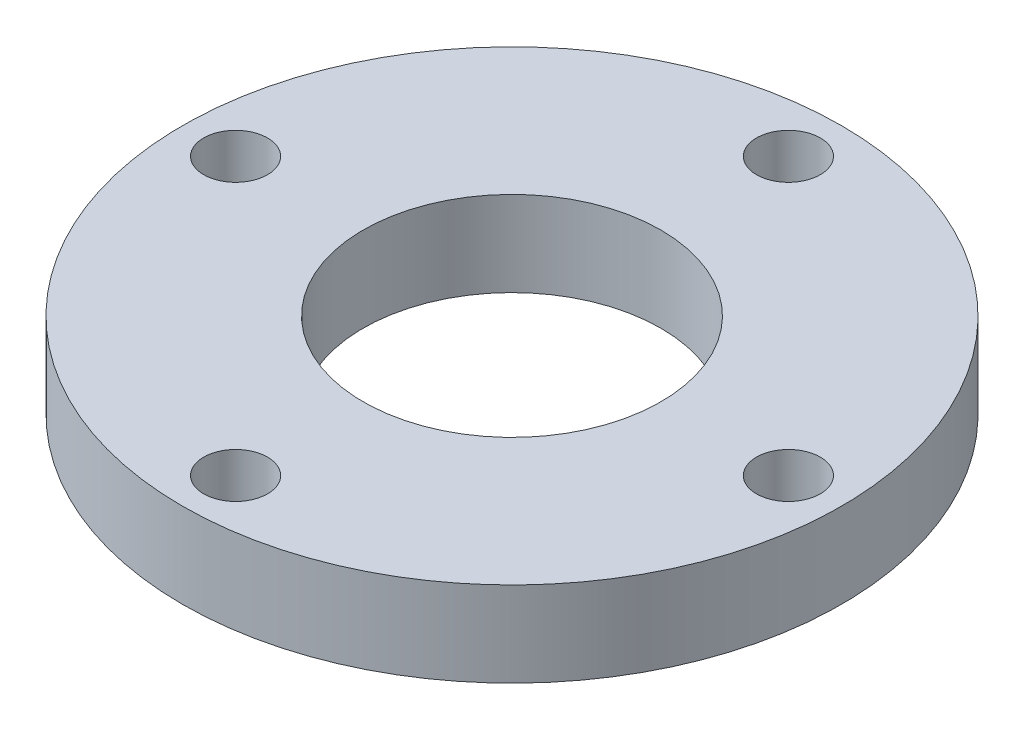
from build123d import *

# Parameters (mm, degrees)
SKETCH1_R           = 15.5
BOSS_EXTRUDE1_DEPTH = 4
SKETCH2_R           = 7
CENTER_HOLE_DEPTH   = 23.282279955
SKETCH3_R           = 1.5
M2_5_HOLE_DEPTH     = 23.282279955
CIRPATTERN1_COUNT   = 4


with BuildPart() as part:
    # Sketch1 → Boss-Extrude1 (new body)
    with BuildSketch(Plane(origin=(0, 0, 0), x_dir=(1, 0, 0), z_dir=(0, 1, 0))):
        with Locations(Location((0, 0, 0), (0, 0, 270))):
            Circle(SKETCH1_R)
    extrude(amount=BOSS_EXTRUDE1_DEPTH)

    # Sketch2 → center hole (cut, through all)
    with BuildSketch(Plane.XZ):
        with Locations(Location((0, 0, 0), (0, 0, 270))):
            Circle(SKETCH2_R)
    extrude(amount=-CENTER_HOLE_DEPTH, mode=Mode.SUBTRACT)

    # Sketch3 → M2.5 hole (cut, through all)
    with BuildSketch(Plane.XZ):
        with Locations(Location((0, 13, 0), (0, 0, 270))):
            Circle(SKETCH3_R)
    m2_5_hole = extrude(amount=-M2_5_HOLE_DEPTH, mode=Mode.SUBTRACT)

    # CirPattern1: M2.5 hole ×4 about axis
    cirpattern1_axis = Axis((0, 0, 0), (0, 1, 0))
    for i in range(1, CIRPATTERN1_COUNT):
        add(m2_5_hole.rotate(cirpattern1_axis, i * 360 / CIRPATTERN1_COUNT), mode=Mode.SUBTRACT)


solid = part.part
